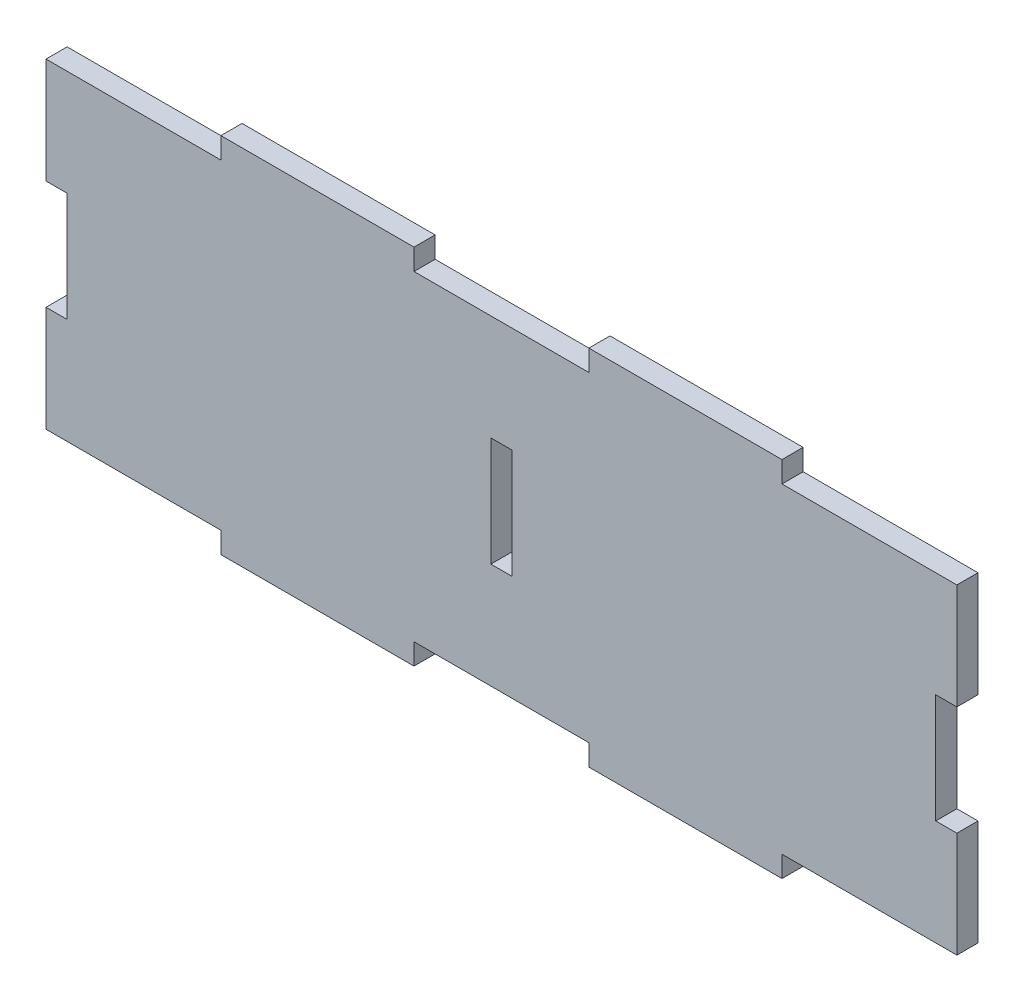
from build123d import *

# Parameters (mm, degrees)
SKETCH_1_W          = 250
SKETCH_1_H          = 88
EXTRUDE_1_DEPTH     = 5.8
CUT_EXTRUDE_1_REACH = 267.099
SKETCH_2_W          = 5.8
SKETCH_2_H          = 30
SKETCH_3_W          = 53
SKETCH_3_H          = 5.8
EXTRUDE_2_DEPTH     = 5.8


with BuildPart() as part:
    # Эскиз1 → Бобышка-Вытянуть1 (new body)
    with BuildSketch(Plane.XY):
        with Locations((125, 44)):
            Rectangle(SKETCH_1_W, SKETCH_1_H)
    extrude(amount=EXTRUDE_1_DEPTH)

    # Эскиз2 → Вырез-Вытянуть1 (cut, up to next)
    with BuildSketch(Plane(origin=(0, 0, 0), x_dir=(-1, 0, 0), z_dir=(0, 0, -1)), mode=Mode.PRIVATE) as cut_extrude_1_sk1:
        with Locations((-247.1, 44)):
            Rectangle(SKETCH_2_W, SKETCH_2_H)
    cut_extrude_1_tool1 = extrude(cut_extrude_1_sk1.sketch, amount=-CUT_EXTRUDE_1_REACH, mode=Mode.PRIVATE) & part.part
    # Эскиз2 → Вырез-Вытянуть1 (cut, up to next)
    with BuildSketch(Plane(origin=(0, 0, 0), x_dir=(-1, 0, 0), z_dir=(0, 0, -1)), mode=Mode.PRIVATE) as cut_extrude_1_sk2:
        with Locations((-125, 44)):
            Rectangle(SKETCH_2_W, SKETCH_2_H)
    cut_extrude_1_tool2 = extrude(cut_extrude_1_sk2.sketch, amount=-CUT_EXTRUDE_1_REACH, mode=Mode.PRIVATE) & part.part
    # Эскиз2 → Вырез-Вытянуть1 (cut, up to next)
    with BuildSketch(Plane(origin=(0, 0, 0), x_dir=(-1, 0, 0), z_dir=(0, 0, -1)), mode=Mode.PRIVATE) as cut_extrude_1_sk3:
        with Locations((-2.9, 44)):
            Rectangle(SKETCH_2_W, SKETCH_2_H)
    cut_extrude_1_tool3 = extrude(cut_extrude_1_sk3.sketch, amount=-CUT_EXTRUDE_1_REACH, mode=Mode.PRIVATE) & part.part
    add(cut_extrude_1_tool1.solids().sort_by_distance((247.1, 44, 0))[0], mode=Mode.SUBTRACT)
    add(cut_extrude_1_tool2.solids().sort_by_distance((125, 44, 0))[0], mode=Mode.SUBTRACT)
    add(cut_extrude_1_tool3.solids().sort_by_distance((2.9, 44, 0))[0], mode=Mode.SUBTRACT)

    # Эскиз3 → Бобышка-Вытянуть2 (add)
    with BuildSketch(Plane.XY.offset(5.8)):
        with Locations((74.5, 90.9)):
            Rectangle(SKETCH_3_W, SKETCH_3_H)
        with Locations((175.5, 90.9)):
            Rectangle(SKETCH_3_W, SKETCH_3_H)
        with Locations((74.5, -2.9)):
            Rectangle(SKETCH_3_W, SKETCH_3_H)
        with Locations((175.5, -2.9)):
            Rectangle(SKETCH_3_W, SKETCH_3_H)
    extrude(amount=-EXTRUDE_2_DEPTH)


solid = part.part
